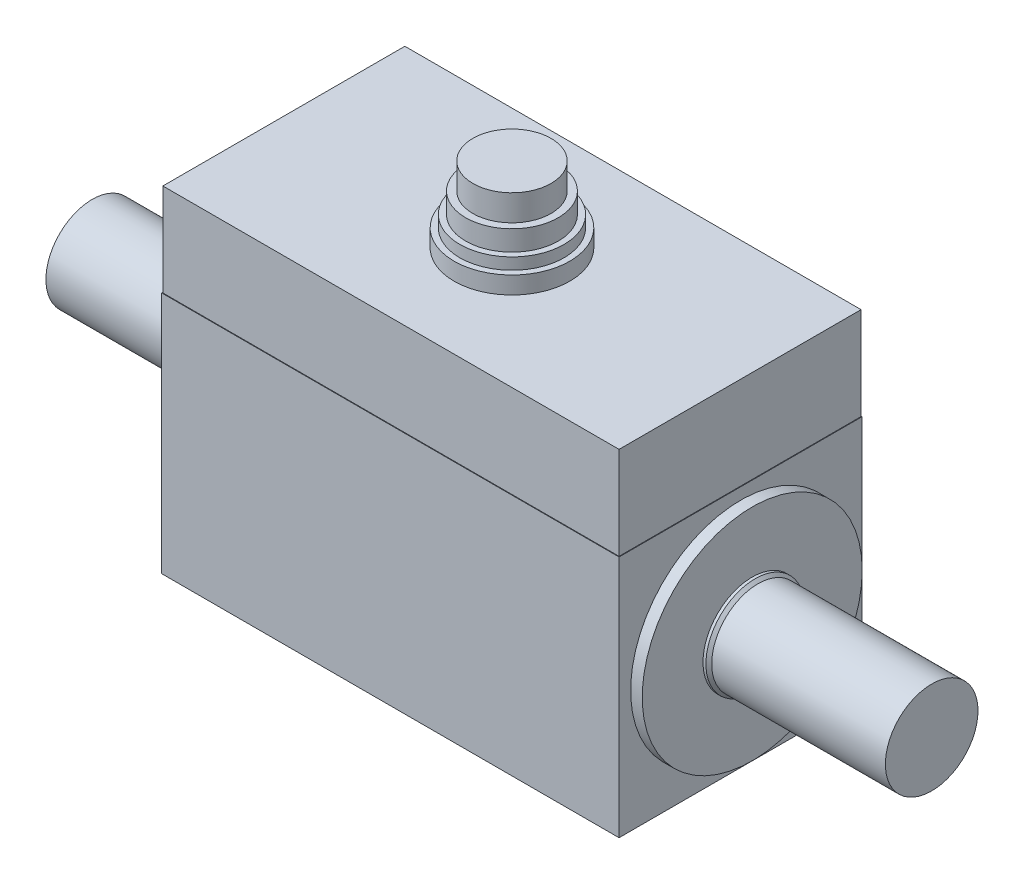
from build123d import *

# Parameters (mm, degrees)
SKETCH1_W                = 79
SKETCH1_H                = 42
BOSS_EXTRUDE1_DEPTH      = 42
SKETCH2_W                = 78.8
SKETCH2_H                = 41.8
BOSS_EXTRUDE2_DEPTH      = 16
SKETCH3_W                = 58
SKETCH3_H                = 26
BOSS_EXTRUDE3_DEPTH      = 0.5
SKETCH4_W                = 42
SKETCH4_H                = 11
CUT_EXTRUDE1_DEPTH       = 0.25
M2_CLEARANCE_HOLE1_D     = 2.459
M2_CLEARANCE_HOLE1_DEPTH = 6.9
M2_CLEARANCE_HOLE1_TIP   = 0.709852156
M2_CLEARANCE_HOLE2_D     = 2.459
M2_CLEARANCE_HOLE2_DEPTH = 7.2
M2_CLEARANCE_HOLE2_TIP   = 0.709852156
CHAMFER1_SIZE            = 0.2705


with BuildPart() as part:
    # Sketch1 → Boss-Extrude1 (new body)
    with BuildSketch(Plane(origin=(0, 21, 0), x_dir=(1, 0, 0), z_dir=(0, 1, 0))):
        Rectangle(SKETCH1_W, SKETCH1_H)
    extrude(amount=-BOSS_EXTRUDE1_DEPTH)

    # Sketch2 → Boss-Extrude2 (add)
    with BuildSketch(Plane(origin=(0, 21, 0), x_dir=(-1, 0, 0), z_dir=(0, 1, 0))):
        Rectangle(SKETCH2_W, SKETCH2_H)
    extrude(amount=BOSS_EXTRUDE2_DEPTH)

    # Sketch3 → Boss-Extrude3 (add)
    with BuildSketch(Plane(origin=(0, 0, -21), x_dir=(-1, 0, 0), z_dir=(0, 0, -1))):
        with Locations((0, 1)):
            Rectangle(SKETCH3_W, SKETCH3_H)
    extrude(amount=BOSS_EXTRUDE3_DEPTH)

    # Sketch4 → Cut-Extrude1 (cut)
    with BuildSketch(Plane(origin=(0, 0, -21.5), x_dir=(-1, 0, 0), z_dir=(0, 0, -1))):
        with Locations((-2, -1.5)):
            Rectangle(SKETCH4_W, SKETCH4_H)
    extrude(amount=-CUT_EXTRUDE1_DEPTH, mode=Mode.SUBTRACT)

    # Sketch5 → Revolve1 (revolve)
    with BuildSketch(Plane(origin=(0, 0, 0), x_dir=(-1, 0, 0), z_dir=(0, 0, -1)), mode=Mode.PRIVATE) as revolve1_sk:
        Polygon((-10, 37), (0, 37), (0, 50), (-6.75, 50), (-6.75, 45.5), (-8, 45.5), (-8, 42), (-9, 42), (-9, 40), (-10, 40), align=None)
    revolve(revolve1_sk.sketch.rotate(Axis((0, 37, 0), (0, 1, 0)), 270), axis=Axis((0, 37, 0), (0, 1, 0)))

    # Sketch6 → Revolve2 (revolve)
    with BuildSketch(Plane.XY, mode=Mode.PRIVATE) as revolve2_sk:
        Polygon((39.5, 19), (39.5, 0), (72.5, 0), (72.5, 8), (42.5, 8), (42, 8.5), (41.5, 8.5), (41.5, 19), align=None)
    revolve(revolve2_sk.sketch.rotate(Axis((39.5, 0, 0), (1, 0, 0)), 270), axis=Axis((39.5, 0, 0), (1, 0, 0)))

    # Sketch7 → Revolve3 (revolve)
    with BuildSketch(Plane.XY, mode=Mode.PRIVATE) as revolve3_sk:
        Polygon((-72.5, 8), (-72.5, 0), (-39.5, 0), (-39.5, 19), (-41.5, 19), (-41.5, 8.5), (-42, 8.5), (-42.5, 8), align=None)
    revolve(revolve3_sk.sketch.rotate(Axis((-72.5, 0, 0), (1, 0, 0)), 270), axis=Axis((-72.5, 0, 0), (1, 0, 0)))

    # M2 Clearance Hole1
    with Locations(Plane.ZY.offset(39.5)):
        with Locations((-16.263455967, 16.263455967), (16.263455967, 16.263455967), (16.263455967, -16.263455967), (-16.263455967, -16.263455967)):
            Hole(M2_CLEARANCE_HOLE1_D / 2, depth=M2_CLEARANCE_HOLE1_DEPTH)
            with Locations((0, 0, -(M2_CLEARANCE_HOLE1_DEPTH + M2_CLEARANCE_HOLE1_TIP / 2))):  # 120° drill point
                Cone(0, M2_CLEARANCE_HOLE1_D / 2, M2_CLEARANCE_HOLE1_TIP, mode=Mode.SUBTRACT)

    # M2 Clearance Hole2
    with Locations(Plane.XZ.offset(21)):
        with Locations((30, 16), (-30, 16), (30, -16), (-30, -16)):
            Hole(M2_CLEARANCE_HOLE2_D / 2, depth=M2_CLEARANCE_HOLE2_DEPTH)
            with Locations((0, 0, -(M2_CLEARANCE_HOLE2_DEPTH + M2_CLEARANCE_HOLE2_TIP / 2))):  # 120° drill point
                Cone(0, M2_CLEARANCE_HOLE2_D / 2, M2_CLEARANCE_HOLE2_TIP, mode=Mode.SUBTRACT)

    # Chamfer1
    chamfer1_edges = [part.edges().sort_by_distance(p)[0] for p in [
        (-28.7705, -21, 16),
        (31.2295, -21, 16),
        (-39.5, -16.263455967, -15.033955967),
        (-39.5, -16.263455967, 17.492955967),
        (-39.5, 16.263455967, 17.492955967),
        (-39.5, 16.263455967, -15.033955967),
        (-28.7705, -21, -16),
        (31.2295, -21, -16),
    ]]
    chamfer(chamfer1_edges, length=CHAMFER1_SIZE)


solid = part.part
